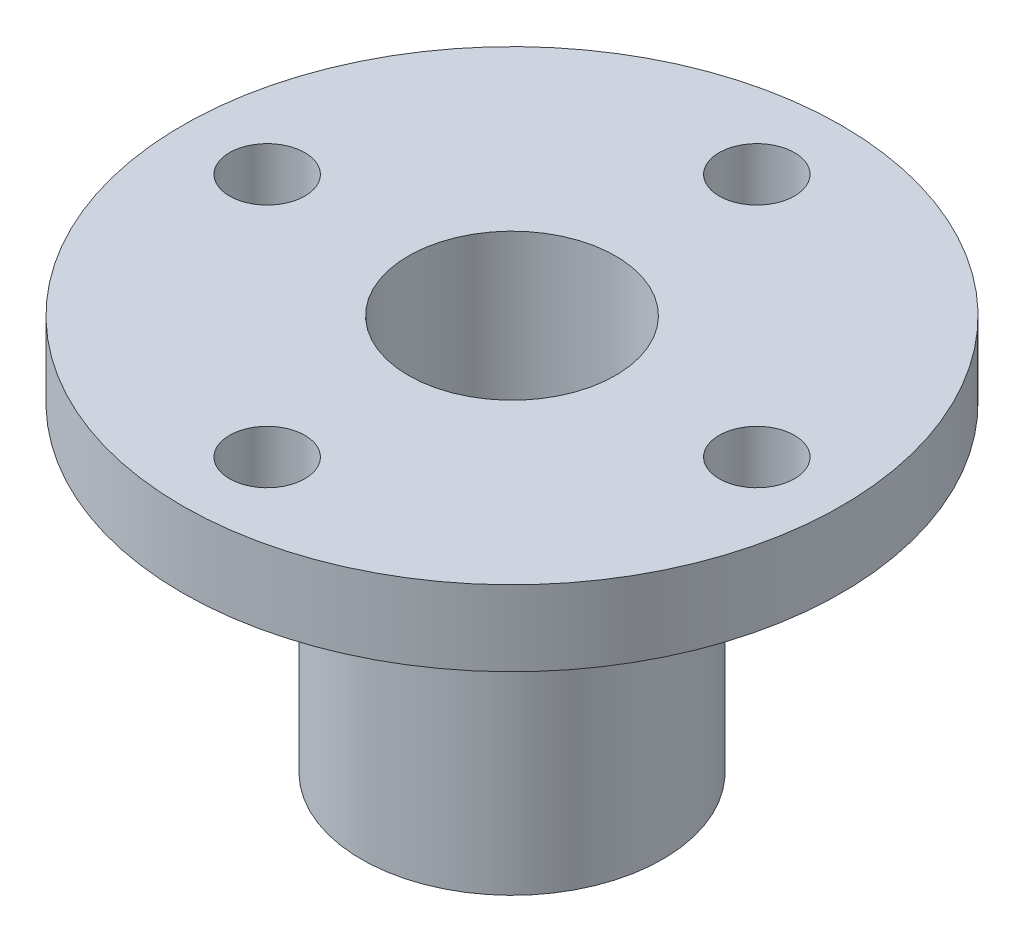
from build123d import *

# Parameters (mm, degrees)
SKETCH1_R           = 17.5
SKETCH1_R_2         = 2
BOSS_EXTRUDE1_DEPTH = 4
SKETCH2_R           = 8
BOSS_EXTRUDE2_DEPTH = 17
SKETCH3_R           = 5.5
CUT_EXTRUDE1_DEPTH  = 12
SKETCH4_R           = 6
CUT_EXTRUDE2_DEPTH  = 1.1
SKETCH5_R           = 5.5
CUT_EXTRUDE3_DEPTH  = 2.9
SKETCH6_R           = 2.75
CUT_EXTRUDE4_DEPTH  = 5.5


with BuildPart() as part:
    # Sketch1 → Boss-Extrude1 (new body)
    with BuildSketch(Plane(origin=(0, 0, 0), x_dir=(1, 0, 0), z_dir=(0, 1, 0))):
        with Locations(Location((0, 0, 0), (0, 0, 270))):
            Circle(SKETCH1_R)
        with Locations(Location((0, 13, 0), (0, 0, 270))):
            Circle(SKETCH1_R_2, mode=Mode.SUBTRACT)
        with Locations(Location((13, 0, 0), (0, 0, 270))):
            Circle(SKETCH1_R_2, mode=Mode.SUBTRACT)
        with Locations(Location((0, -13, 0), (0, 0, 270))):
            Circle(SKETCH1_R_2, mode=Mode.SUBTRACT)
        with Locations(Location((-13, 0, 0), (0, 0, 270))):
            Circle(SKETCH1_R_2, mode=Mode.SUBTRACT)
    extrude(amount=BOSS_EXTRUDE1_DEPTH)

    # Sketch2 → Boss-Extrude2 (add)
    with BuildSketch(Plane.XZ):
        with Locations(Location((0, 0, 0), (0, 0, 270))):
            Circle(SKETCH2_R)
    extrude(amount=BOSS_EXTRUDE2_DEPTH)

    # Sketch3 → Cut-Extrude1 (cut)
    with BuildSketch(Plane(origin=(0, 4, 0), x_dir=(1, 0, 0), z_dir=(0, 1, 0))):
        with Locations(Location((0, 0, 0), (0, 0, 270))):
            Circle(SKETCH3_R)
    extrude(amount=-CUT_EXTRUDE1_DEPTH, mode=Mode.SUBTRACT)

    # Sketch4 → Cut-Extrude2 (cut)
    with BuildSketch(Plane(origin=(0, -8, 0), x_dir=(1, 0, 0), z_dir=(0, 1, 0))):
        with Locations(Location((0, 0, 0), (0, 0, 270))):
            Circle(SKETCH4_R)
    extrude(amount=-CUT_EXTRUDE2_DEPTH, mode=Mode.SUBTRACT)

    # Sketch5 → Cut-Extrude3 (cut)
    with BuildSketch(Plane(origin=(0, -9.1, 0), x_dir=(1, 0, 0), z_dir=(0, 1, 0))):
        with Locations(Location((0, 0, 0), (0, 0, 270))):
            Circle(SKETCH5_R)
    extrude(amount=-CUT_EXTRUDE3_DEPTH, mode=Mode.SUBTRACT)

    # Sketch6 → Cut-Extrude4 (cut)
    with BuildSketch(Plane.XZ.offset(17)):
        with Locations(Location((0, 0, 0), (0, 0, 270))):
            Circle(SKETCH6_R)
    extrude(amount=-CUT_EXTRUDE4_DEPTH, mode=Mode.SUBTRACT)


solid = part.part
